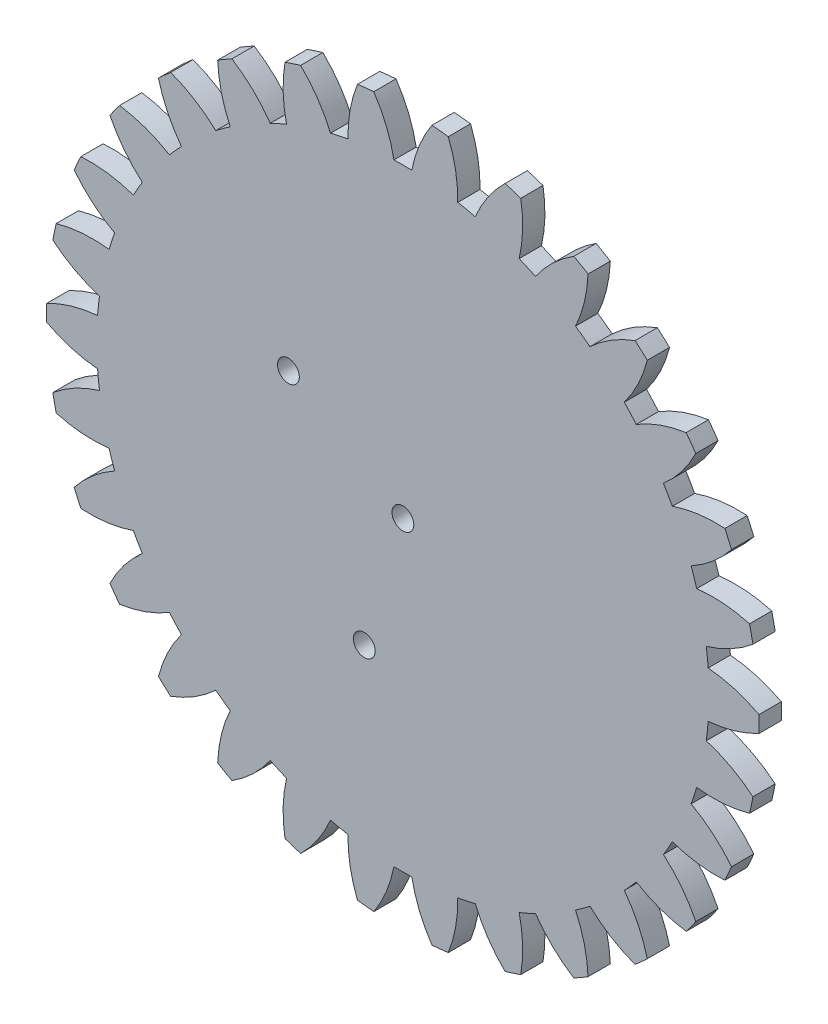
from build123d import *

# Parameters (mm, degrees)
SKETCH1_R           = 48
BOSS_EXTRUDE1_DEPTH = 3
CUT_EXTRUDE1_DEPTH  = 68.948509917
CIRPATTERN1_COUNT   = 30
SKETCH7_R           = 1.47
CUT_EXTRUDE2_DEPTH  = 68.835567074
SKETCH8_R           = 1.47
CUT_EXTRUDE3_DEPTH  = 68.835567074


with BuildPart() as part:
    # Sketch1 → Boss-Extrude1 (new body)
    with BuildSketch(Plane.XY):
        Circle(SKETCH1_R)
    extrude(amount=BOSS_EXTRUDE1_DEPTH)

    # Sketch2 → Cut-Extrude1 (cut, through all)
    with BuildSketch(Plane.XY.offset(3)):
        with BuildLine():
            ThreePointArc((-1.20388032, 41.232428648), (0, 41.25), (1.20388032, 41.232428648))
            ThreePointArc((1.20388032, 41.232428648), (2.228958391, 44.672086233), (3.916100076, 47.839984952))
            ThreePointArc((3.916100076, 47.839984952), (0, 48), (-3.916100076, 47.839984952))
            ThreePointArc((-3.916100076, 47.839984952), (-2.228958391, 44.672086233), (-1.20388032, 41.232428648))
        make_face()
    cut_extrude1 = extrude(amount=-CUT_EXTRUDE1_DEPTH, mode=Mode.SUBTRACT)

    # CirPattern1: Cut-Extrude1 ×30 about axis
    cirpattern1_axis = Axis((0, 0, 0), (0, 0, 1))
    for i in range(1, CIRPATTERN1_COUNT):
        add(cut_extrude1.rotate(cirpattern1_axis, i * 360 / CIRPATTERN1_COUNT), mode=Mode.SUBTRACT)

    # Sketch7 → Cut-Extrude2 (cut, through all)
    with BuildSketch(Plane(origin=(0, 0, 0), x_dir=(-1, 0, 0), z_dir=(0, 0, -1))):
        Circle(SKETCH7_R)
    extrude(amount=-CUT_EXTRUDE2_DEPTH, mode=Mode.SUBTRACT)

    # Sketch8 → Cut-Extrude3 (cut, through all)
    with BuildSketch(Plane(origin=(0, 0, 0), x_dir=(-1, 0, 0), z_dir=(0, 0, -1))):
        with Locations((5.200050154, -17.363038426)):
            Circle(SKETCH8_R)
        with Locations((15.425535223, 9.516747768)):
            Circle(SKETCH8_R)
    extrude(amount=-CUT_EXTRUDE3_DEPTH, mode=Mode.SUBTRACT)


solid = part.part
